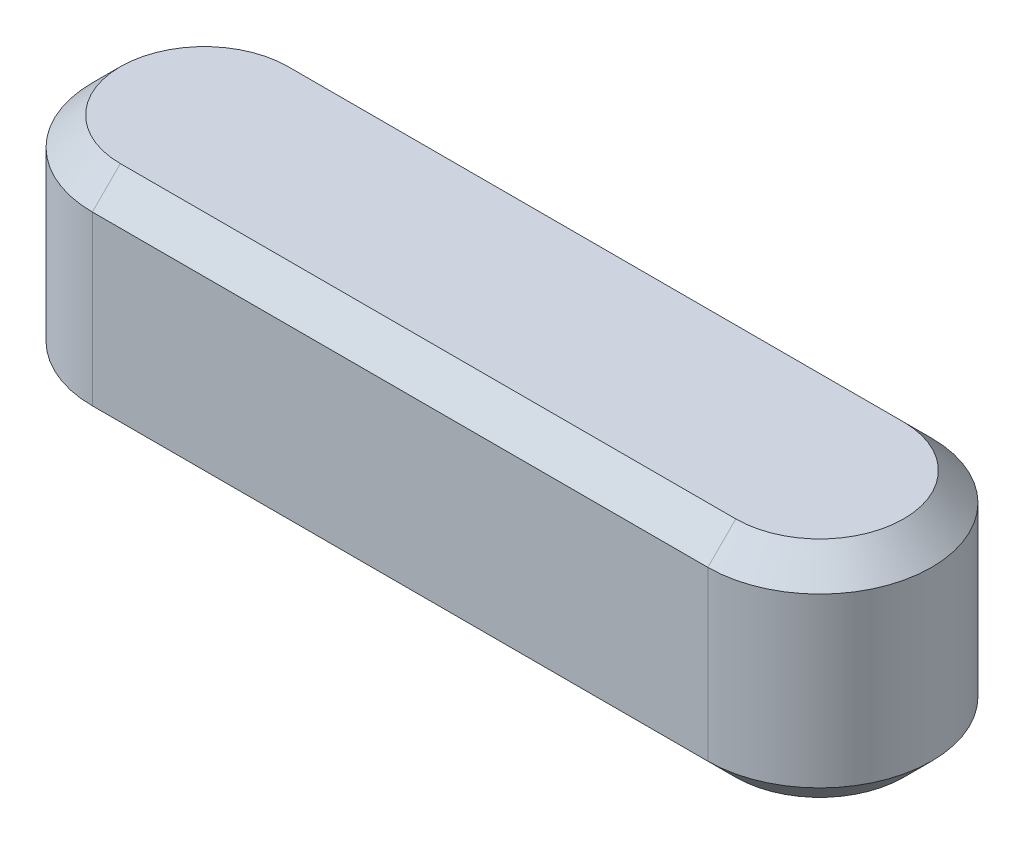
from build123d import *

# Parameters (mm, degrees)
BOSS_EXTRUDE1_DEPTH = 4
CHAMFER1_SIZE       = 0.5


with BuildPart() as part:
    # Sketch1 → Boss-Extrude1 (new body)
    with BuildSketch(Plane(origin=(0, 0, 0), x_dir=(1, 0, 0), z_dir=(0, 1, 0))):
        with BuildLine():
            Line((-5.5, 2), (5.5, 2))
            ThreePointArc((5.5, 2), (7.5, 0), (5.5, -2))
            Line((5.5, -2), (-5.5, -2))
            ThreePointArc((-5.5, -2), (-7.5, 0), (-5.5, 2))
        make_face()
    extrude(amount=BOSS_EXTRUDE1_DEPTH)

    # Chamfer1
    chamfer1_edges = [part.edges().sort_by_distance(p)[0] for p in [
        (-7.5, 4, 0),
        (0, 4, 2),
        (7.5, 4, 0),
        (0, 0, 2),
        (-7.5, 0, 0),
        (0, 0, -2),
        (7.5, 0, 0),
        (0, 4, -2),
    ]]
    chamfer(chamfer1_edges, length=CHAMFER1_SIZE)


solid = part.part
